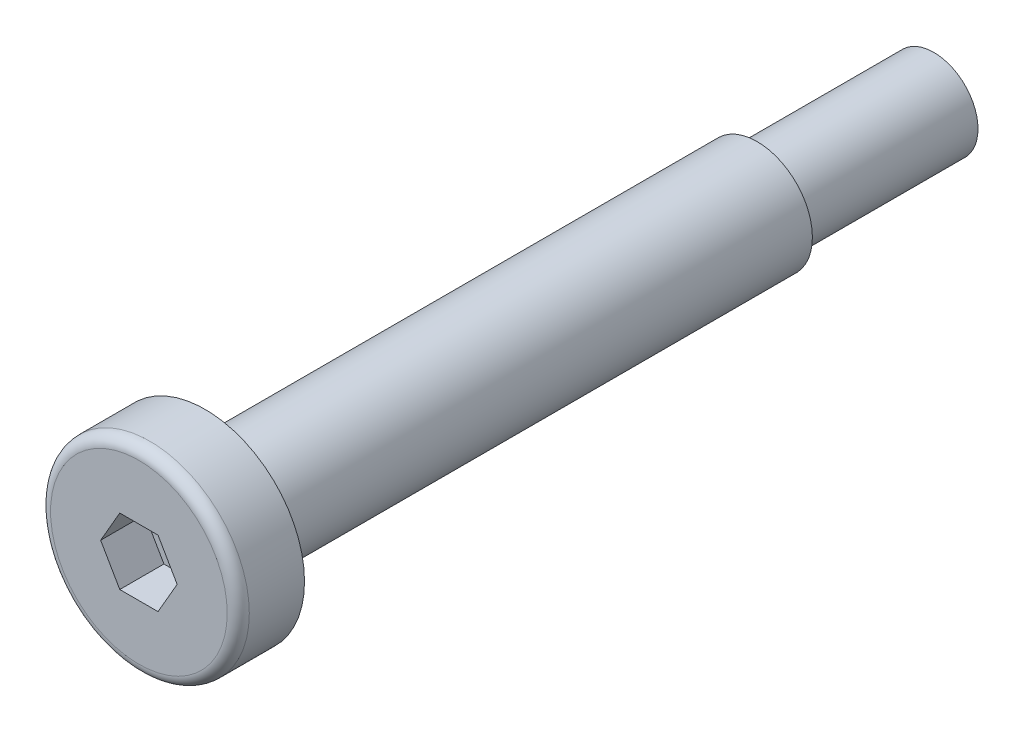
from build123d import *

# Parameters (mm, degrees)
SKETCH_1_R          = 4.5
EXTRUDE_1_DEPTH     = 3
SKETCH_2_R          = 2.5
EXTRUDE_2_DEPTH     = 25
EXTRUDE_START       = -25
SKETCH_3_R          = 2
EXTRUDE_3_DEPTH     = 8
CUT_EXTRUDE_START   = 3
CUT_EXTRUDE_1_DEPTH = 2
FILLET_1_R          = 0.5


with BuildPart() as part:
    # 草图1 → 凸台-拉伸1 (new body)
    with BuildSketch(Plane.XY):
        Circle(SKETCH_1_R)
    extrude(amount=EXTRUDE_1_DEPTH)

    # 草图2 → 凸台-拉伸2 (add)
    with BuildSketch(Plane.XY):
        Circle(SKETCH_2_R)
    extrude(amount=-EXTRUDE_2_DEPTH)

    # 草图3 → 凸台-拉伸3 (add)
    with BuildSketch(Plane.XY.offset(EXTRUDE_START)):
        Circle(SKETCH_3_R)
    extrude(amount=-EXTRUDE_3_DEPTH)

    # 草图4 → 切除-拉伸1 (cut)
    with BuildSketch(Plane.XY.offset(CUT_EXTRUDE_START)):
        Polygon((1.732050808, 0), (0.866025404, 1.5), (-0.866025404, 1.5), (-1.732050808, 0), (-0.866025404, -1.5), (0.866025404, -1.5), align=None)
    extrude(amount=-CUT_EXTRUDE_1_DEPTH, mode=Mode.SUBTRACT)

    # 圆角1
    fillet_1_edges = [part.edges().sort_by_distance(p)[0] for p in [
        (-4.5, 0, 3),
    ]]
    fillet(fillet_1_edges, radius=FILLET_1_R)


solid = part.part
